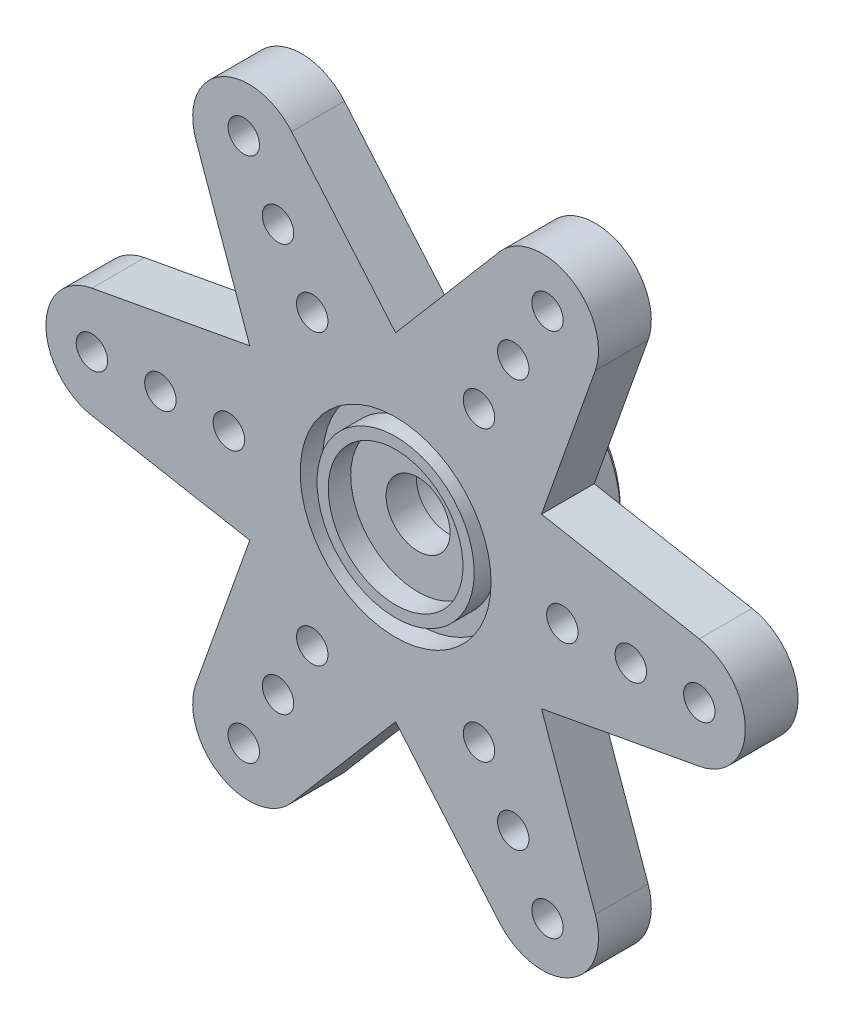
from build123d import *

# Parameters (mm, degrees)
BOSS_EXTRU_1_DEPTH                  = 2.35
DIAM_TRE_DU_PER_AGE_8_5_8_5_1_D     = 8.5
DIAM_TRE_DU_PER_AGE_8_5_8_5_1_DEPTH = 1
ESQUISSE4_W                         = 4.4
ESQUISSE4_H                         = 3.5
ESQUISSE5_W                         = 3.5
ESQUISSE5_H                         = 1
DIAM_TRE_DU_PER_AGE_1_4_1_4_1_D     = 1.4
DIAM_TRE_DU_PER_AGE_1_4_1_4_1_DEPTH = 5.85
CHANFREIN1_SIZE                     = 0.25


with BuildPart() as part:
    # Esquisse1 → Boss.-Extru.1 (new body)
    with BuildSketch(Plane(origin=(0, 0, 0), x_dir=(-1, 0, 0), z_dir=(0, 0, -1))):
        with BuildLine():
            Line((0, 7.5), (-4.633054626, 12.942429446))
            ThreePointArc((-4.633054626, 12.942429446), (-7.786695956, 13.486953019), (-8.891945374, 10.483557726))
            Line((-8.891945374, 10.483557726), (-6.495190528, 3.75))
            Line((-6.495190528, 3.75), (-13.525, 2.45887172))
            ThreePointArc((-13.525, 2.45887172), (-15.573391912, 0), (-13.525, -2.45887172))
            Line((-13.525, -2.45887172), (-6.495190528, -3.75))
            Line((-6.495190528, -3.75), (-8.891945374, -10.483557726))
            ThreePointArc((-8.891945374, -10.483557726), (-7.786695956, -13.486953019), (-4.633054626, -12.942429446))
            Line((-4.633054626, -12.942429446), (0, -7.5))
            Line((0, -7.5), (4.633054626, -12.942429446))
            ThreePointArc((4.633054626, -12.942429446), (7.786695956, -13.486953019), (8.891945374, -10.483557726))
            Line((8.891945374, -10.483557726), (6.495190528, -3.75))
            Line((6.495190528, -3.75), (13.525, -2.45887172))
            ThreePointArc((13.525, -2.45887172), (15.573391912, 0), (13.525, 2.45887172))
            Line((13.525, 2.45887172), (6.495190528, 3.75))
            Line((6.495190528, 3.75), (8.891945374, 10.483557726))
            ThreePointArc((8.891945374, 10.483557726), (7.786695956, 13.486953019), (4.633054626, 12.942429446))
            Line((4.633054626, 12.942429446), (0, 7.5))
        make_face()
    extrude(amount=-BOSS_EXTRU_1_DEPTH)

    # Diamètre du perçage Ø8.5 (8.5)1
    with Locations(Plane.XY.offset(2.35)):
        with Locations((0, 0)):
            Hole(DIAM_TRE_DU_PER_AGE_8_5_8_5_1_D / 2, depth=DIAM_TRE_DU_PER_AGE_8_5_8_5_1_DEPTH)

    # Esquisse4 → Révolution1 (revolve)
    with BuildSketch(Plane(origin=(0, 0, 0), x_dir=(1, 0, 0), z_dir=(0, 1, 0))):
        with Locations((2.2, 1.75)):
            Rectangle(ESQUISSE4_W, ESQUISSE4_H)
    revolve(axis=Axis((0, 0, -3.5), (0, 0, 1)))

    # Esquisse5 → Révolution2 (revolve)
    with BuildSketch(Plane(origin=(0, 0, 0), x_dir=(1, 0, 0), z_dir=(0, 1, 0))):
        with Locations((1.75, -1.85)):
            Rectangle(ESQUISSE5_W, ESQUISSE5_H)
    revolve(axis=Axis((0, 0, 1.35), (0, 0, 1)))

    # Esquisse6 → Enlèvement de matière-Révolution1 (revolve, cut)
    with BuildSketch(Plane.XZ, mode=Mode.PRIVATE) as enl_vement_de_mati_re_r_volution1_sk:
        Polygon((3, 2.35), (0, 2.35), (0, -3.5), (2.65, -3.5), (2.65, 0), (1.425, 0), (1.425, 1.35), (3, 1.35), align=None)
    revolve(enl_vement_de_mati_re_r_volution1_sk.sketch.rotate(Axis((0, 0, 2.35), (0, 0, -1)), 180), axis=Axis((0, 0, 2.35), (0, 0, -1)), mode=Mode.SUBTRACT)

    # Diamètre du perçage Ø1.4 (1.4)1
    with Locations(Plane.XY.offset(2.35)):
        with Locations((6.7625, 11.712993586), (3.7125, 6.430238623), (-5.2375, 9.071616105), (-13.525, 0), (-7.425, 0), (-5.2375, -9.071616105), (6.7625, -11.712993586), (3.7125, -6.430238623), (10.475, 0), (7.425, 0), (13.525, 0), (5.2375, -9.071616105), (-3.7125, -6.430238623), (-6.7625, -11.712993586), (-10.475, 0), (-3.7125, 6.430238623), (-6.7625, 11.712993586), (5.2375, 9.071616105)):
            Hole(DIAM_TRE_DU_PER_AGE_1_4_1_4_1_D / 2, depth=DIAM_TRE_DU_PER_AGE_1_4_1_4_1_DEPTH)

    # Chanfrein1
    chanfrein1_edges = [part.edges().sort_by_distance(p)[0] for p in [
        (-4.4, 0, -3.5),
    ]]
    chamfer(chanfrein1_edges, length=CHANFREIN1_SIZE)


solid = part.part
